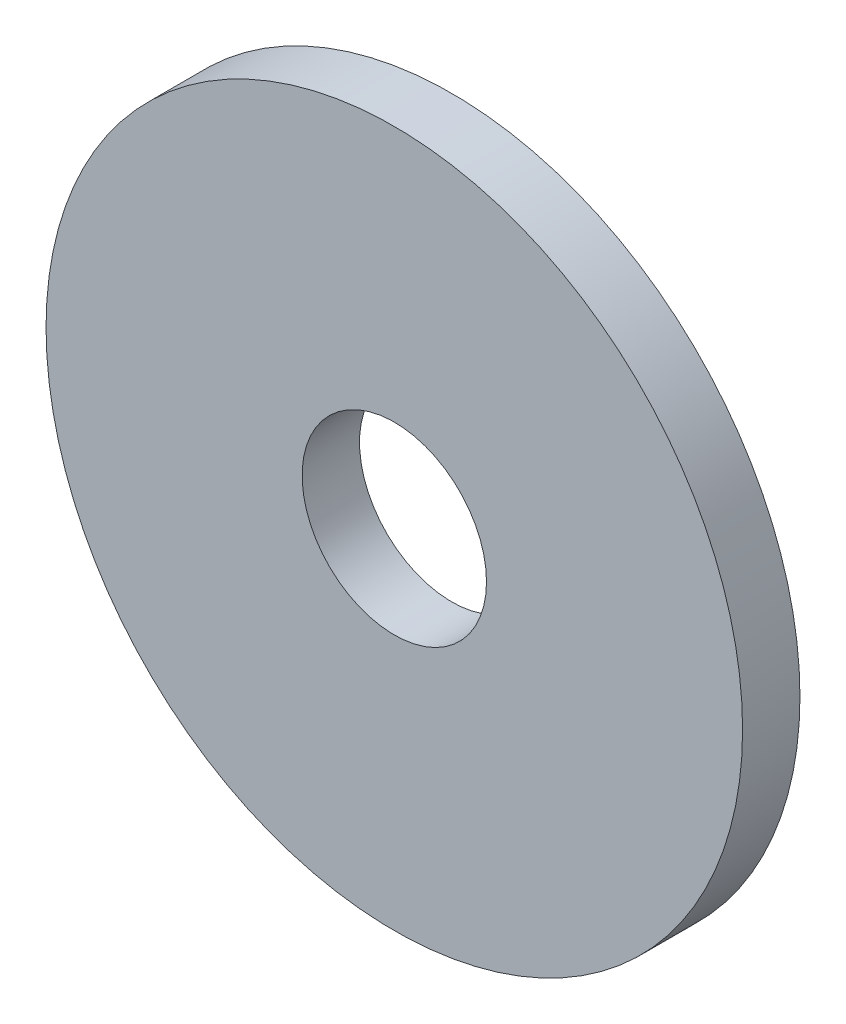
from build123d import *

# Parameters (mm, degrees)
SKICA1_R                = 8.5
SKICA1_R_2              = 2.25
P_IDAT_VYSUNUT_M1_DEPTH = 1.4


with BuildPart() as part:
    # Skica1 → Přidat vysunutím1 (new body)
    with BuildSketch(Plane.XY):
        Circle(SKICA1_R)
        Circle(SKICA1_R_2, mode=Mode.SUBTRACT)
    extrude(amount=P_IDAT_VYSUNUT_M1_DEPTH)


solid = part.part
